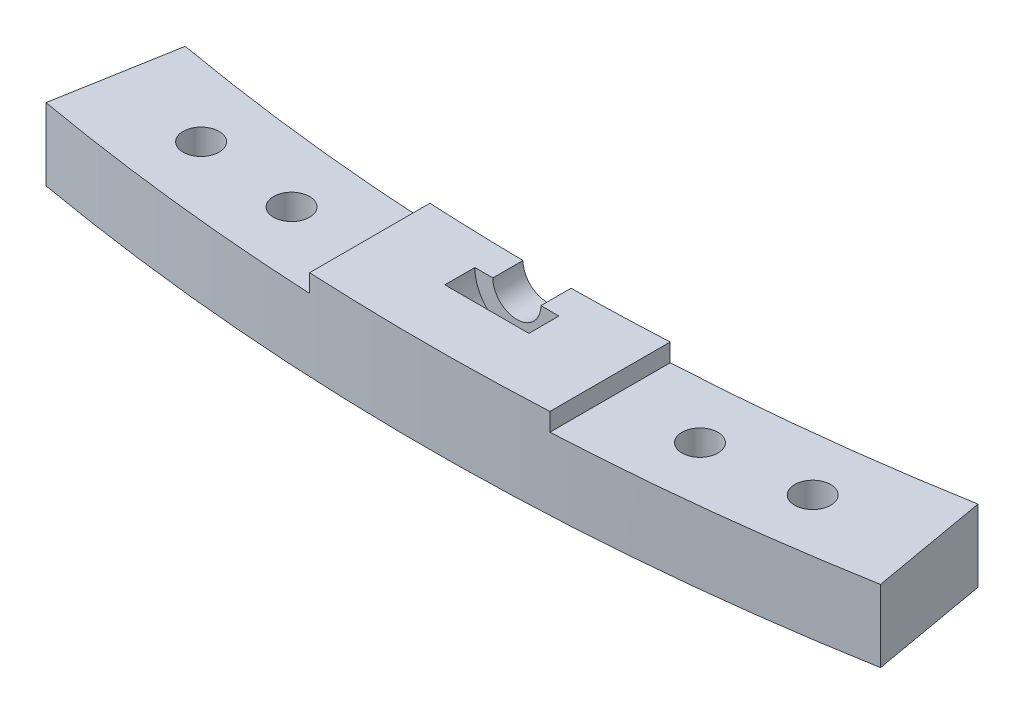
from build123d import *

# Parameters (mm, degrees)
BOSS_EXTRUDE3_DEPTH     = 6
BOSS_EXTRUDE3_2_DEPTH   = 6
BOSS_EXTRUDE4_DEPTH     = 7.5
CUT_EXTRUDE1_DEPTH      = 204.131478569
CUT_EXTRUDE1_DEPTH_BACK = 204.131478569
SKETCH4_R               = 1.5


with BuildPart() as part:
    # Sketch2 → Boss-Extrude3 (new body)
    with BuildSketch(Plane(origin=(0, -7.5, 0), x_dir=(1, 0, 0), z_dir=(0, 1, 0))):
        with BuildLine():
            ThreePointArc((-10, -189.73665961), (-21.536552519, -188.775466906), (-32.993153757, -187.113473072))
            Line((-32.993153757, -187.113473072), (-34.729635533, -196.961550602))
            ThreePointArc((-34.729635533, -196.961550602), (-22.408228804, -198.7407137), (-10, -199.749843554))
            Line((-10, -199.749843554), (-10, -189.73665961))
        make_face()
    extrude(amount=BOSS_EXTRUDE3_DEPTH)



with BuildPart() as body_2:
    # Sketch2 → Boss-Extrude3 2 (new body)
    with BuildSketch(Plane(origin=(0, -7.5, 0), x_dir=(1, 0, 0), z_dir=(0, 1, 0))):
        with BuildLine():
            ThreePointArc((32.993153757, -187.113473072), (21.536552519, -188.775466906), (10, -189.73665961))
            Line((10, -189.73665961), (10, -199.749843554))
            ThreePointArc((10, -199.749843554), (22.408228804, -198.7407137), (34.729635533, -196.961550602))
            Line((34.729635533, -196.961550602), (32.993153757, -187.113473072))
        make_face()
    extrude(amount=BOSS_EXTRUDE3_2_DEPTH)


with BuildPart() as part_1:
    add(part.part)

    add(body_2.part)  # Boss-Extrude4 merges body 2
    # Sketch2<3> → Boss-Extrude4 (add)
    with BuildSketch(Plane(origin=(0, -7.5, 0), x_dir=(1, 0, 0), z_dir=(0, 1, 0))):
        with BuildLine():
            ThreePointArc((10, -189.73665961), (0, -190), (-10, -189.73665961))
            Line((-10, -189.73665961), (-10, -199.749843554))
            ThreePointArc((-10, -199.749843554), (0, -200), (10, -199.749843554))
            Line((10, -199.749843554), (10, -189.73665961))
        make_face()
    extrude(amount=BOSS_EXTRUDE4_DEPTH)

    # Sketch3 → hole (revolve, cut)
    with BuildSketch(Plane(origin=(0, 0, 0), x_dir=(1, 0, 0), z_dir=(0, 1, 0))):
        Polygon((3.5, -192.5), (2, -192.5), (2, -180), (0, -180), (0, -195), (3.5, -195), align=None)
    revolve(axis=Axis((0, 0, 0), (0, 0, 1)), mode=Mode.SUBTRACT)

    # Sketch4 → Cut-Extrude1 (cut, two sides: drawn at the far end of the back side and taken through both)
    with BuildSketch(Plane.XZ.offset(7.5).offset(-CUT_EXTRUDE1_DEPTH_BACK)):
        with Locations(Location((25.452607483, 193.331747968, 0), (0, 0, 90))):
            Circle(SKETCH4_R)
        with Locations(Location((16.995369836, 194.257966128, 0), (0, 0, 90))):
            Circle(SKETCH4_R)
        with Locations(Location((-25.452607483, 193.331747968, 0), (0, 0, 90))):
            Circle(SKETCH4_R)
        with Locations(Location((-16.995369836, 194.257966128, 0), (0, 0, 90))):
            Circle(SKETCH4_R)
    extrude(amount=CUT_EXTRUDE1_DEPTH + CUT_EXTRUDE1_DEPTH_BACK, mode=Mode.SUBTRACT)


solid = part_1.part
